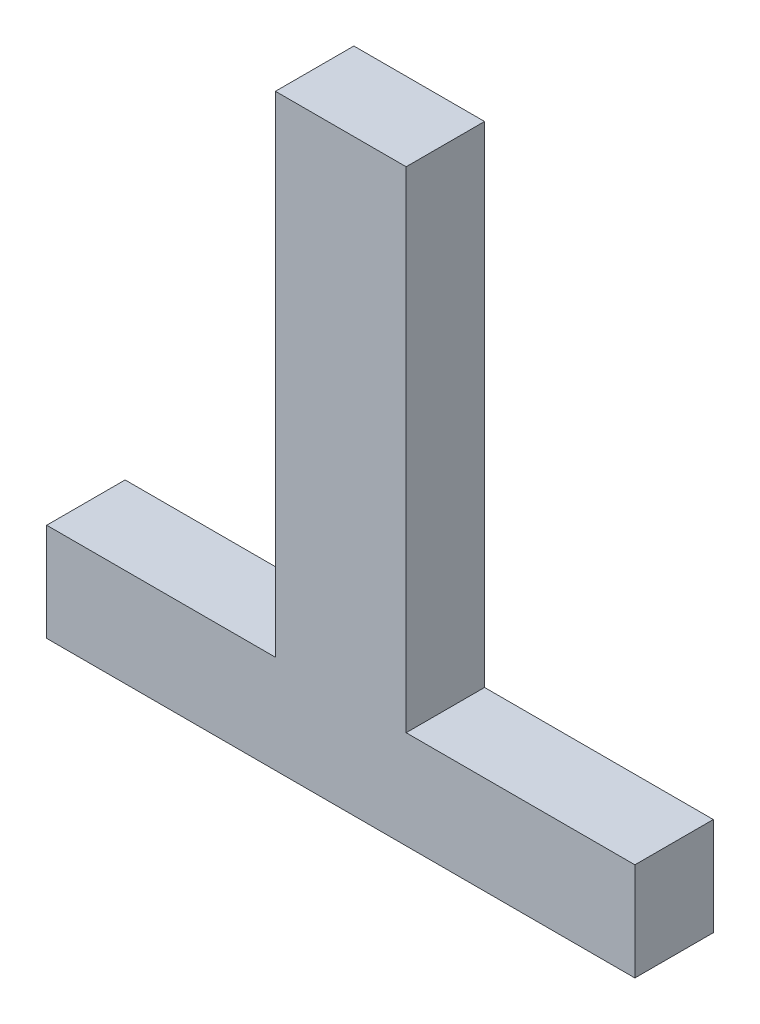
from build123d import *

# Parameters (mm, degrees)
EXTRUDE_1_DEPTH = 12


with BuildPart() as part:
    # 草图1 → 凸台-拉伸1 (new body)
    with BuildSketch(Plane.XY):
        Polygon((-45, 0), (45, 0), (45, 15), (10, 15), (10, 90), (-10, 90), (-10, 15), (-45, 15), align=None)
    extrude(amount=EXTRUDE_1_DEPTH)


solid = part.part
